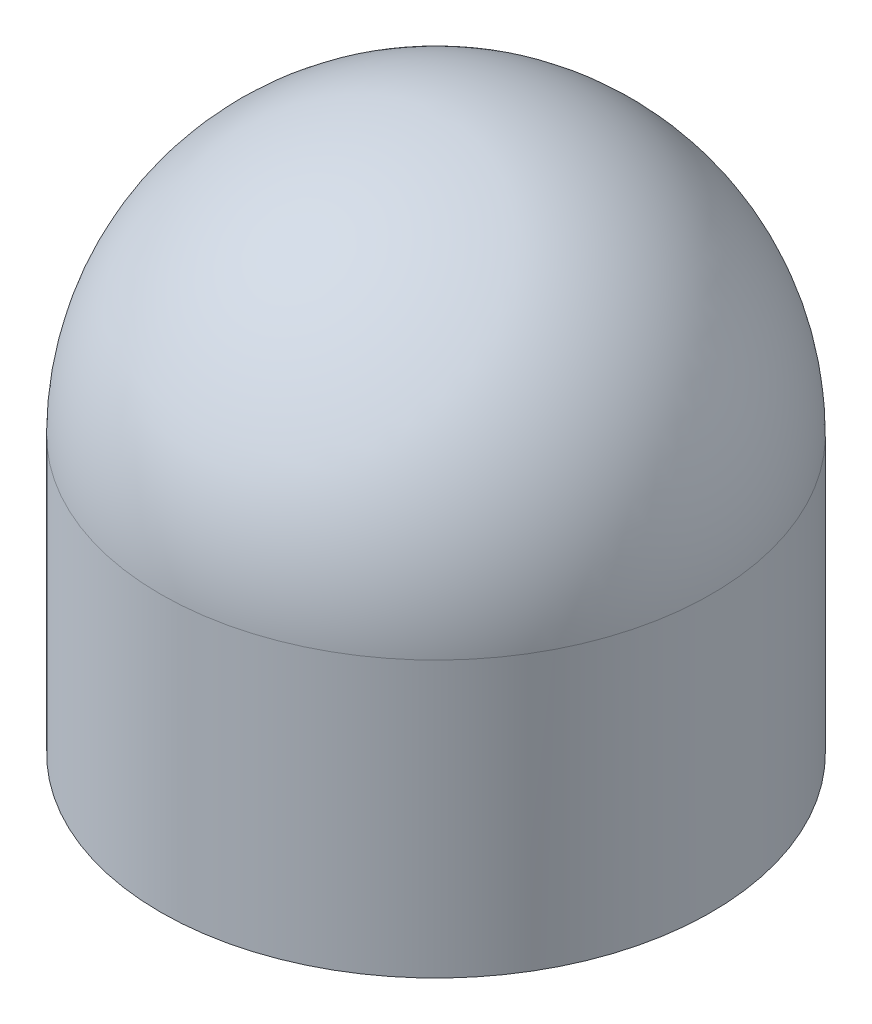
from build123d import *


with BuildPart() as part:
    # Sketch1 → Revolve-Thin1 (revolve)
    with BuildSketch(Plane(origin=(0, 0, 0), x_dir=(0, 0, -1), z_dir=(1, 0, 0))):
        with BuildLine():
            Line((88.9, 0), (88.9, 88.9))
            ThreePointArc((88.9, 88.9), (62.861792847, 151.761792847), (0, 177.8))
            Line((0, 177.8), (0, 171.45))
            ThreePointArc((0, 171.45), (58.371664787, 147.271664787), (82.55, 88.9))
            Line((82.55, 88.9), (82.55, 0))
            Line((82.55, 0), (88.9, 0))
        make_face()
    revolve(axis=Axis((0, 177.8, 0), (0, -1, 0)))


solid = part.part
